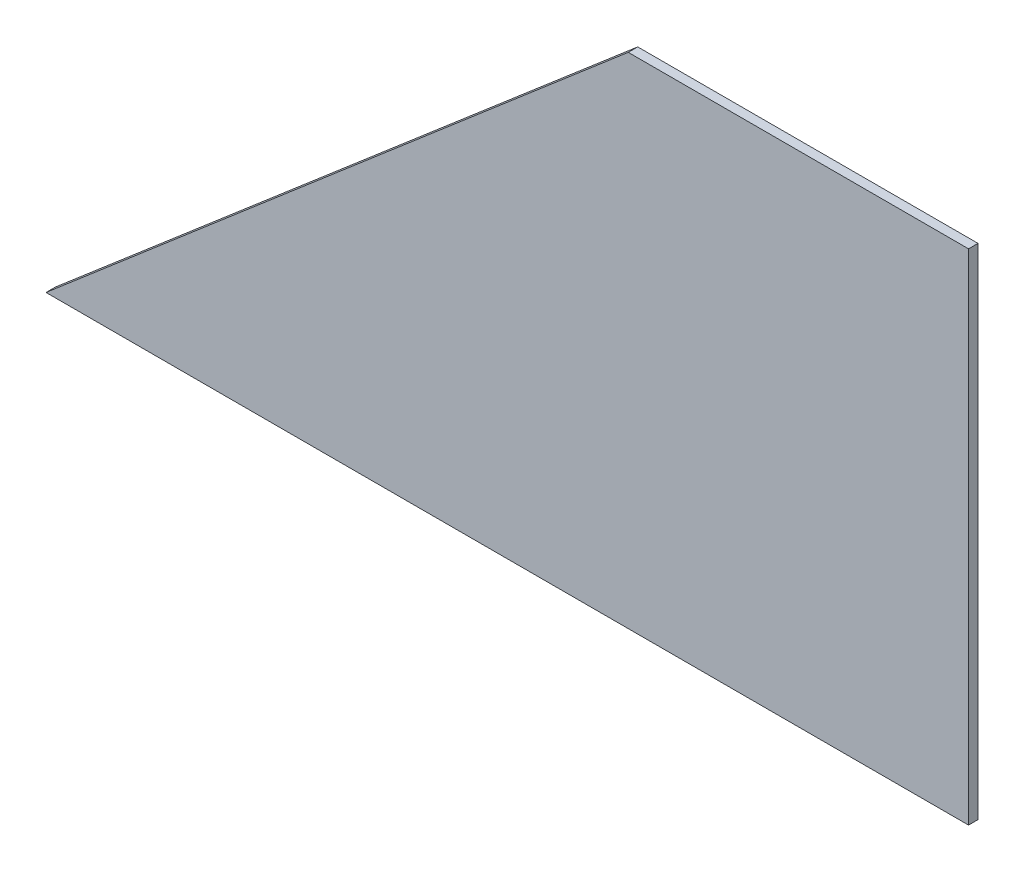
from build123d import *

# Parameters (mm, degrees)
SKETCH1_W                = 381
SKETCH1_H                = 50.8
BOSS_EXTRUDE1_DEPTH      = 10
BOSS_EXTRUDE2_DEPTH      = 1.5875
BOSS_EXTRUDE2_DEPTH_BACK = 1.5875
SKETCH3_W                = 381
SKETCH3_H                = 50.8
CUT_EXTRUDE1_DEPTH       = 420.338538176


with BuildPart() as part:
    # Sketch1 → Boss-Extrude1 (new body)
    with BuildSketch(Plane(origin=(0, 0, 0), x_dir=(1, 0, 0), z_dir=(0, 1, 0))):
        with Locations((190.5, 25.4)):
            Rectangle(SKETCH1_W, SKETCH1_H)
    extrude(amount=BOSS_EXTRUDE1_DEPTH)

    # Sketch3 → Cut-Extrude1 (cut, through all)
    with BuildSketch(Plane(origin=(0, 10, 0), x_dir=(1, 0, 0), z_dir=(0, 1, 0))):
        with Locations((190.5, 25.4)):
            Rectangle(SKETCH3_W, SKETCH3_H)
    extrude(amount=-CUT_EXTRUDE1_DEPTH, mode=Mode.SUBTRACT)


with BuildPart() as body_2:
    # Sketch2 → Boss-Extrude2 (new, two sides: drawn at the far end of the back side and taken through both)
    with BuildSketch(Plane.XY.offset(-25.4).offset(-BOSS_EXTRUDE2_DEPTH_BACK)):
        Polygon((347.867965721, 10), (37.987965721, 10), (233.567965721, 177.64), (347.867965721, 177.64), align=None)
    extrude(amount=BOSS_EXTRUDE2_DEPTH + BOSS_EXTRUDE2_DEPTH_BACK)


solid = body_2.part
